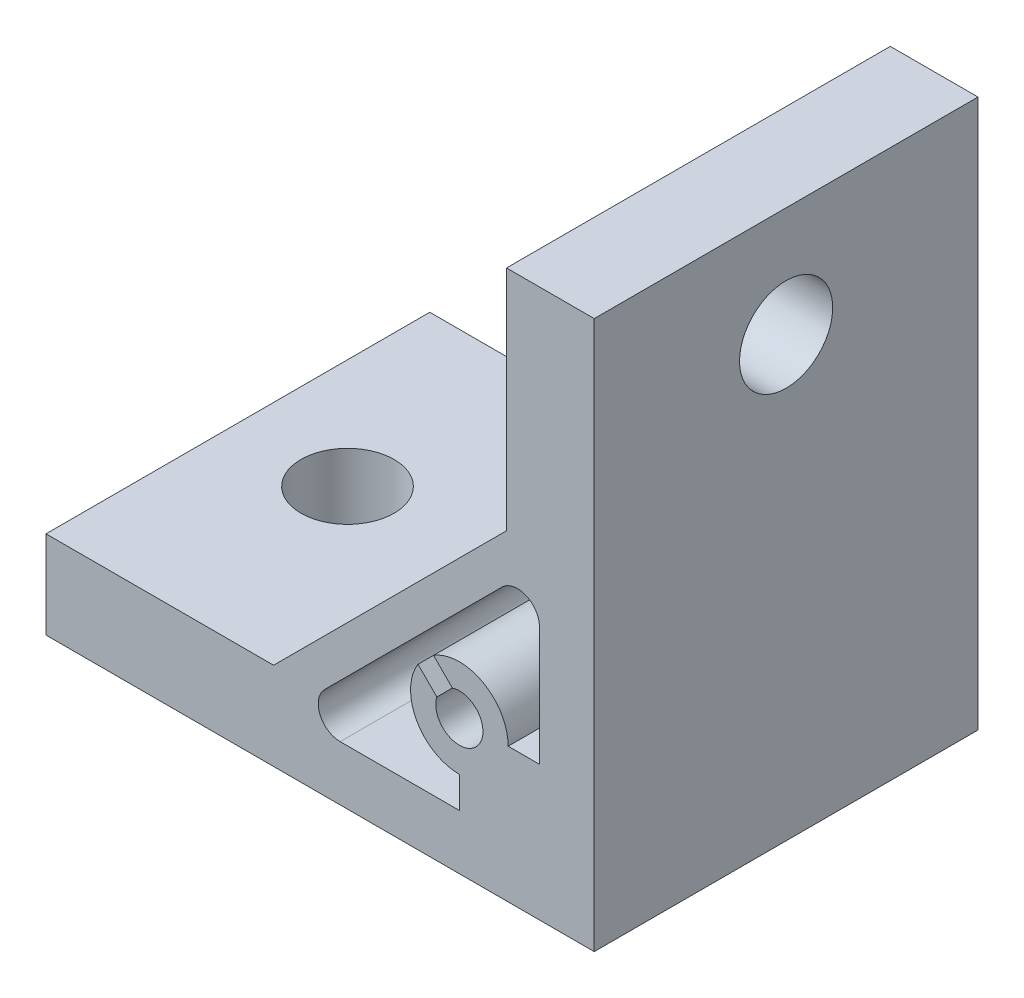
from build123d import *

# Parameters (mm, degrees)
EXTRUDE_1_DEPTH     = 17.5
SKETCH_3_R          = 4.25
CUT_EXTRUDE_1_DEPTH = 68.603624163


with BuildPart() as part:
    # 草图1 → 凸台-拉伸1 (new, symmetric)
    with BuildSketch(Plane.XY):
        Polygon((0, 0), (50, 0), (50, 50), (42, 50), (42, 29.242640687), (20.757359313, 8), (0, 8), align=None)
        with BuildLine():
            Line((37.061279898, 14.352933665), (35.340960992, 16.07325257))
            ThreePointArc((35.340960992, 16.07325257), (39.856939547, 16.192314452), (42.15, 12.3))
            Line((42.15, 12.3), (45, 12.3))
            Line((45, 12.3), (45, 23.171572875))
            ThreePointArc((45, 23.171572875), (43.765366865, 25.01933194), (41.585786438, 24.585786438))
            Line((41.585786438, 24.585786438), (25.414213562, 8.414213562))
            ThreePointArc((25.414213562, 8.414213562), (24.98066806, 6.234633135), (26.828427125, 5))
            Line((26.828427125, 5), (37.7, 5))
            Line((37.7, 5), (37.7, 7.85))
            ThreePointArc((37.7, 7.85), (33.807685548, 10.143060453), (33.92674743, 14.659039008))
            Line((33.92674743, 14.659039008), (35.647066335, 12.938720102))
            ThreePointArc((35.647066335, 12.938720102), (39.22027958, 10.77972042), (37.061279898, 14.352933665))
        make_face(mode=Mode.SUBTRACT)
    extrude(amount=EXTRUDE_1_DEPTH, both=True)

    # 草图3 → 切除-拉伸1 (cut, through all)
    with BuildSketch(Plane(origin=(0, 8, 0), x_dir=(1, 0, 0), z_dir=(0, 1, 0))):
        with Locations(Location((10, 0, 0), (0, 0, 270))):
            Circle(SKETCH_3_R)
    cut_extrude_1 = extrude(amount=-CUT_EXTRUDE_1_DEPTH, mode=Mode.SUBTRACT)

    # 镜向1: 切除-拉伸1 across plane
    add(cut_extrude_1.mirror(Plane(origin=(25, 25, 0), x_dir=(0, 0, 1), z_dir=(0.7071067811865488, 0.7071067811865464, 0))), mode=Mode.SUBTRACT)


solid = part.part
